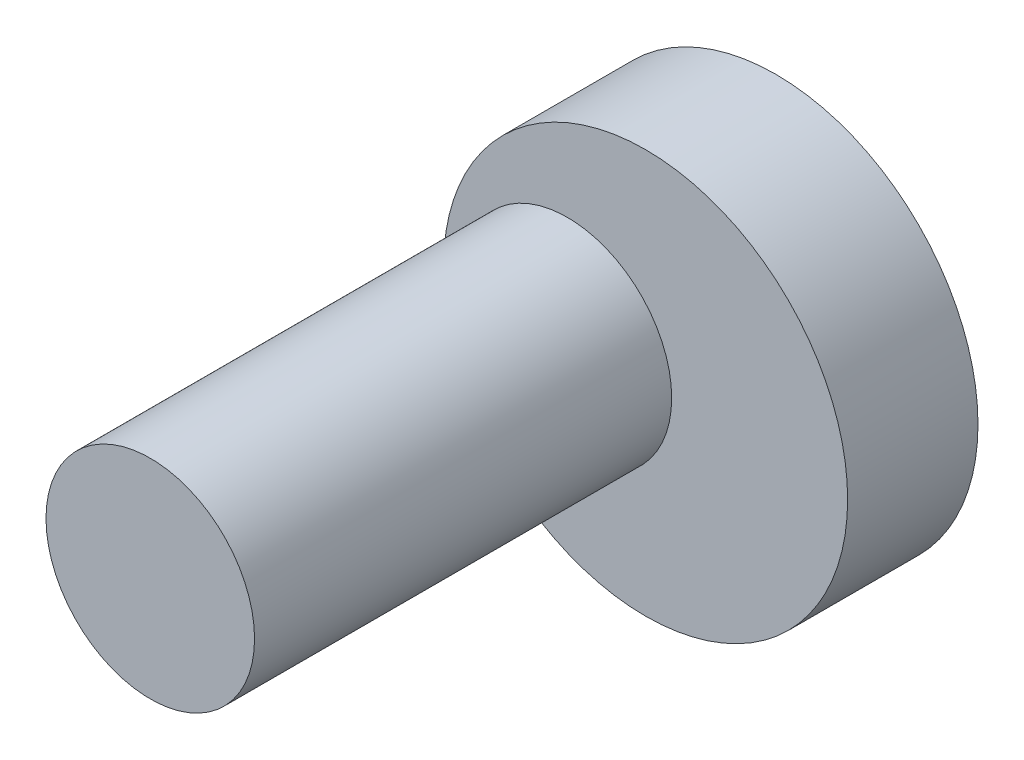
from build123d import *

# Parameters (mm, degrees)
SKETCH_1_R      = 15.5
EXTRUDE_1_DEPTH = 10
SKETCH_2_R      = 8
EXTRUDE_2_DEPTH = 32


with BuildPart() as part:
    # 草图1 → 凸台-拉伸1 (new body)
    with BuildSketch(Plane.XY):
        Circle(SKETCH_1_R)
    extrude(amount=EXTRUDE_1_DEPTH)

    # 草图2 → 凸台-拉伸2 (add)
    with BuildSketch(Plane.XY.offset(10)):
        with Locations((-6, 0)):
            Circle(SKETCH_2_R)
    extrude(amount=EXTRUDE_2_DEPTH)


solid = part.part
